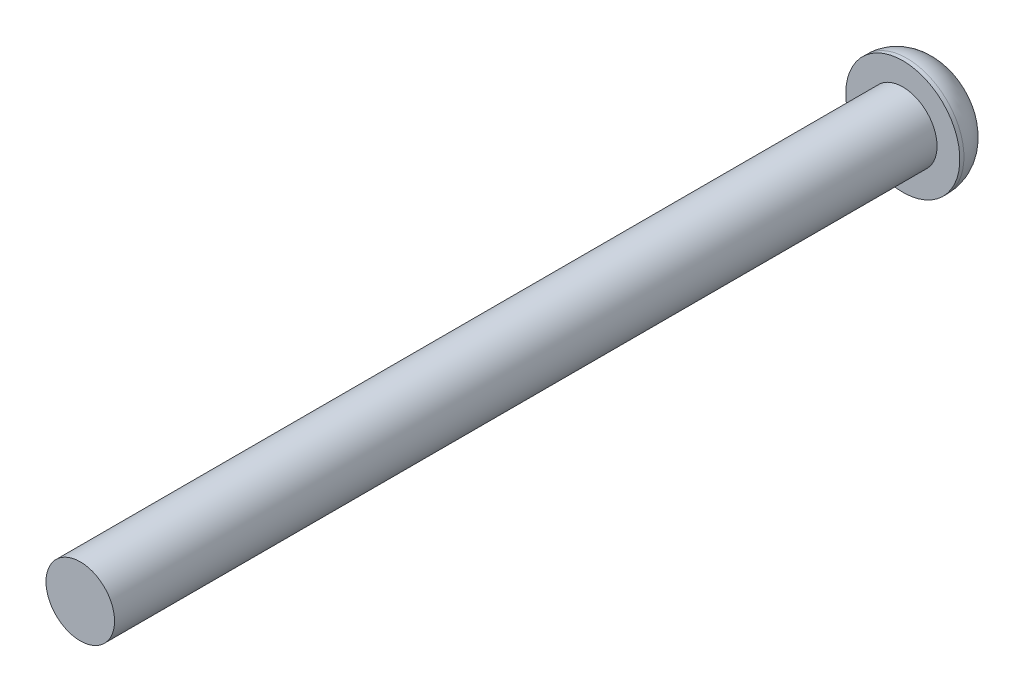
from build123d import *

# Parameters (mm, degrees)
SKETCH1_R           = 2.5
BOSS_EXTRUDE1_DEPTH = 60
SKETCH2_R           = 4.159584877
BOSS_EXTRUDE2_DEPTH = 2.8
FILLET1_R           = 2.5
CUT_EXTRUDE1_DEPTH  = 2


with BuildPart() as part:
    # Sketch1 → Boss-Extrude1 (new body)
    with BuildSketch(Plane.XY):
        Circle(SKETCH1_R)
    extrude(amount=BOSS_EXTRUDE1_DEPTH)

    # Sketch2 → Boss-Extrude2 (add)
    with BuildSketch(Plane(origin=(0, 0, 0), x_dir=(-1, 0, 0), z_dir=(0, 0, -1))):
        Circle(SKETCH2_R)
    extrude(amount=BOSS_EXTRUDE2_DEPTH)

    # Fillet1
    fillet1_edges = [part.edges().sort_by_distance(p)[0] for p in [
        (4.159584877, 0, -2.8),
    ]]
    fillet(fillet1_edges, radius=FILLET1_R)

    # Sketch3 → Cut-Extrude1 (cut)
    with BuildSketch(Plane(origin=(0, 0, -2.8), x_dir=(-1, 0, 0), z_dir=(0, 0, -1))):
        Polygon((1.392434699, -0.636521364), (1.247461021, 0.88762314), (-0.144973678, 1.524144504), (-1.392434699, 0.636521364), (-1.247461021, -0.88762314), (0.144973678, -1.524144504), align=None)
    extrude(amount=-CUT_EXTRUDE1_DEPTH, mode=Mode.SUBTRACT)


solid = part.part
